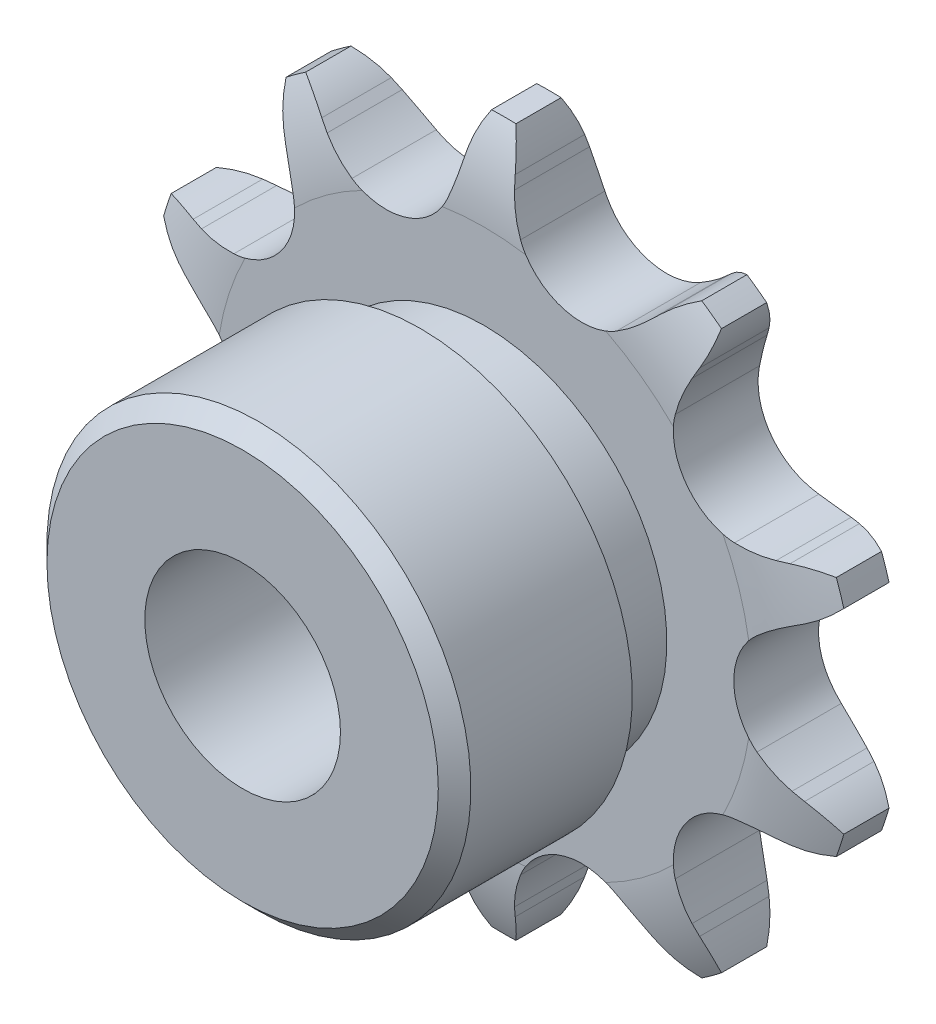
from build123d import *

# Parameters (mm, degrees)
CUT_EXTRUDE1_DEPTH      = 16.657152091
CIRPATTERN1_COUNT       = 10
BOSS_EXTRUDE1_START     = 1.3
SKETCH2_R               = 6.5
BOSS_EXTRUDE1_DEPTH     = 7.4
CUT_EXTRUDE2_DEPTH      = 18.583589407
CUT_EXTRUDE2_DEPTH_BACK = 18.583589407
SKETCH3_R               = 3
SKETCH4_W               = 1.95
SKETCH4_H               = 5.42484668
CUT_EXTRUDE3_DEPTH      = 18.583589407
CUT_EXTRUDE3_DEPTH_BACK = 18.583589407
SKETCH5_OUTSIDE_W       = 29.576
SKETCH5_OUTSIDE_H       = 30.498
SKETCH5_OUTSIDE_R       = 10.85


with BuildPart() as part:
    # Sketch1 → Revolve1 (revolve)
    with BuildSketch(Plane(origin=(0, 0, 0), x_dir=(0, 0, -1), z_dir=(1, 0, 0))):
        with BuildLine():
            Line((1.3, 0), (-1.3, 0))
            Line((-1.3, 0), (-1.3, 8.220578389))
            ThreePointArc((-1.3, 8.220578389), (-1.122370651, 9.669716064), (-0.6, 11.033050612))
            Line((-0.6, 11.033050612), (0.6, 11.033050612))
            ThreePointArc((0.6, 11.033050612), (1.122370651, 9.669716064), (1.3, 8.220578389))
            Line((1.3, 8.220578389), (1.3, 0))
        make_face()
    revolve(axis=Axis((0, 0, -1.3), (0, 0, 1)))

    # Sketch0 → Cut-Extrude1 (cut, symmetric)
    with BuildSketch(Plane.XY):
        with BuildLine():
            Line((5.206978722, -8.39850295), (4.957782126, -8.162849443))
            ThreePointArc((4.957782126, -8.162849443), (4.524874775, -7.795717311), (4.054849481, -7.477486263))
            ThreePointArc((4.054849481, -7.477486263), (2.367102294, -7.285191761), (1.11471401, -8.432794187))
            ThreePointArc((1.11471401, -8.432794187), (0.921507076, -8.966522449), (0.787072525, -9.51799514))
            Line((0.787072525, -9.51799514), (0.7239819, -9.855116916))
            ThreePointArc((0.7239819, -9.855116916), (-0.816170309, -12.105988792), (-3.51662429, -12.488142326))
            ThreePointArc((-3.51662429, -12.488142326), (4.009134908, -12.338848505), (10.185354701, -8.036099474))
            ThreePointArc((10.185354701, -8.036099474), (7.776017326, -9.314217796), (5.206978722, -8.39850295))
        make_face()
    cut_extrude1 = extrude(amount=CUT_EXTRUDE1_DEPTH, both=True, mode=Mode.SUBTRACT)

    # CirPattern1: Cut-Extrude1 ×10 about axis
    cirpattern1_axis = Axis((0, 0, 0), (0, 0, 1))
    for i in range(1, CIRPATTERN1_COUNT):
        add(cut_extrude1.rotate(cirpattern1_axis, i * 360 / CIRPATTERN1_COUNT), mode=Mode.SUBTRACT)

    # Sketch2 → Boss-Extrude1 (add)
    with BuildSketch(Plane.XY.offset(BOSS_EXTRUDE1_START)):
        with Locations(Location((0, 0, 0), (0, 0, 270))):
            Circle(SKETCH2_R)
    extrude(amount=BOSS_EXTRUDE1_DEPTH)

    # Sketch3 → Cut-Extrude2 (cut, two sides: drawn at the far end of the back side and taken through both)
    with BuildSketch(Plane.XY.offset(-CUT_EXTRUDE2_DEPTH_BACK)):
        Circle(SKETCH3_R)
    extrude(amount=CUT_EXTRUDE2_DEPTH + CUT_EXTRUDE2_DEPTH_BACK, mode=Mode.SUBTRACT)

    # Sketch4 → Cut-Revolve1 (revolve, cut)
    with BuildSketch(Plane(origin=(0, 0, 0), x_dir=(0, 0, -1), z_dir=(1, 0, 0))):
        Polygon((-8.7, 6.5), (-8.7, 6), (-8.2, 6.5), align=None)
        with Locations((-2.275, 8.320627272)):
            Rectangle(SKETCH4_W, SKETCH4_H)
    revolve(axis=Axis((0, 0, -1.3), (0, 0, 1)), mode=Mode.SUBTRACT)

    # Sketch5 outside → Cut-Extrude3 (cut, two sides: drawn at the far end of the back side and taken through both)
    with BuildSketch(Plane.XY.offset(-CUT_EXTRUDE3_DEPTH_BACK)):
        Rectangle(SKETCH5_OUTSIDE_W, SKETCH5_OUTSIDE_H)
        Circle(SKETCH5_OUTSIDE_R, mode=Mode.SUBTRACT)
    extrude(amount=CUT_EXTRUDE3_DEPTH + CUT_EXTRUDE3_DEPTH_BACK, mode=Mode.SUBTRACT)


solid = part.part
